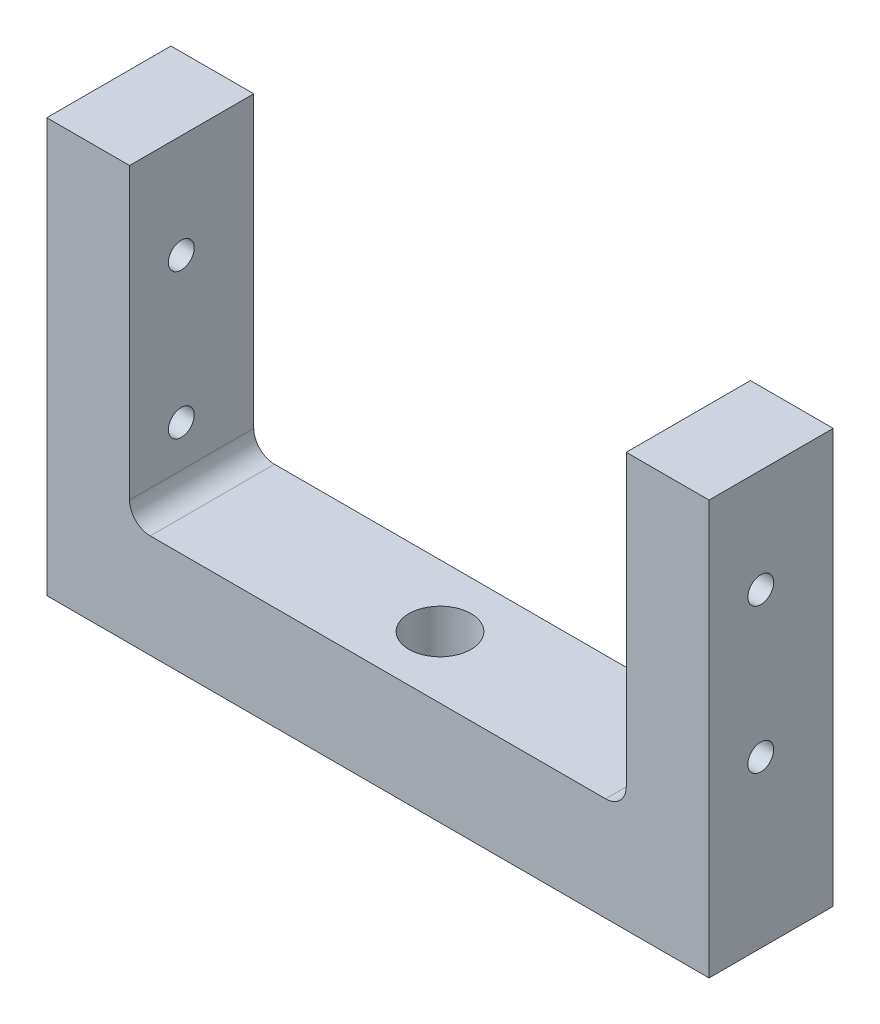
from build123d import *

# Parameters (mm, degrees)
BOSS_EXTRU_1_DEPTH      = 6
ESQUISSE2_R             = 1.5
ENL_V_MAT_EXTRU_1_DEPTH = 5
ESQUISSE3_R             = 0.625
ENL_V_MAT_EXTRU_2_DEPTH = 35.058772732
CONG_2_R                = 1
CONG_3_R                = 1


with BuildPart() as part:
    # Esquisse1 → Boss.-Extru.1 (new body)
    with BuildSketch(Plane.XY):
        Polygon((-12, 10), (-16, 10), (-16, -10), (16, -10), (16, 10), (12, 10), (12, -5), (-12, -5), align=None)
    extrude(amount=BOSS_EXTRU_1_DEPTH)

    # Esquisse2 → Enlèv. mat.-Extru.1 (cut)
    with BuildSketch(Plane(origin=(0, -5, 0), x_dir=(1, 0, 0), z_dir=(0, 1, 0))):
        with Locations(Location((0, -3, 0), (0, 0, 270))):
            Circle(ESQUISSE2_R)
    extrude(amount=-ENL_V_MAT_EXTRU_1_DEPTH, mode=Mode.SUBTRACT)

    # Esquisse3 → Enlèv. mat.-Extru.2 (cut, through all)
    with BuildSketch(Plane(origin=(16, 0, 0), x_dir=(0, 0, -1), z_dir=(1, 0, 0))):
        with Locations((-3.5, 5)):
            Circle(ESQUISSE3_R)
        with Locations((-3.5, -2)):
            Circle(ESQUISSE3_R)
    extrude(amount=-ENL_V_MAT_EXTRU_2_DEPTH, mode=Mode.SUBTRACT)

    # Congé2
    cong_2_edges = [part.edges().sort_by_distance(p)[0] for p in [
        (-12, -5, 3),
    ]]
    fillet(cong_2_edges, radius=CONG_2_R)

    # Congé3
    cong_3_edges = [part.edges().sort_by_distance(p)[0] for p in [
        (12, -5, 3),
    ]]
    fillet(cong_3_edges, radius=CONG_3_R)


solid = part.part
